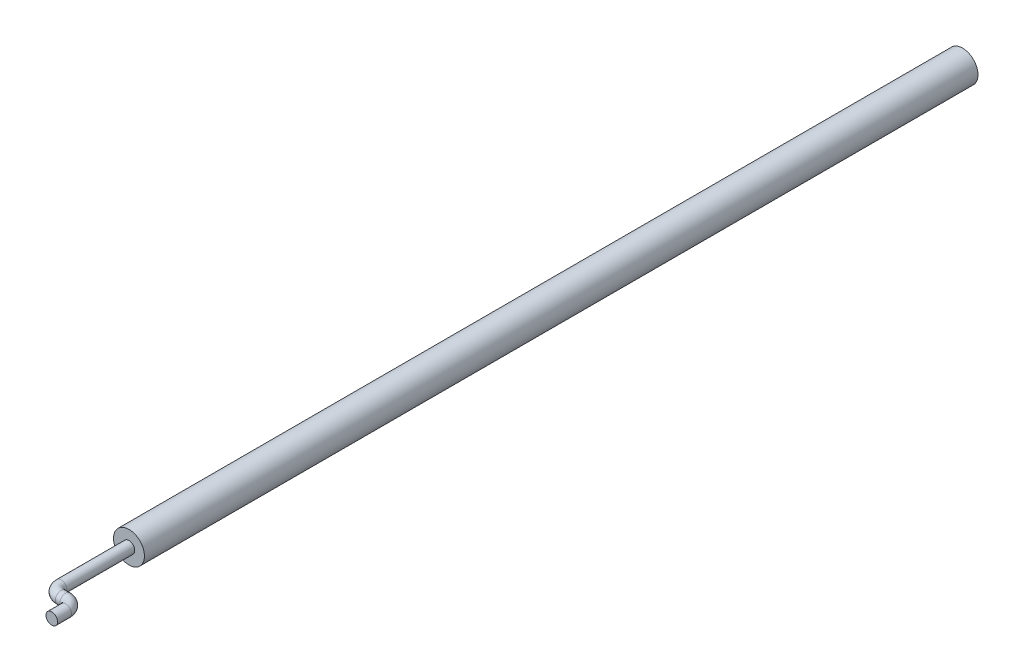
from build123d import *

# Parameters (mm, degrees)
SKETCH1_R           = 50.8
BOSS_EXTRUDE1_DEPTH = 2743.2
SKETCH6_R           = 19.05


with BuildPart() as part:
    # Sketch1 → Boss-Extrude1 (new body)
    with BuildSketch(Plane.XY):
        Circle(SKETCH1_R)
    extrude(amount=BOSS_EXTRUDE1_DEPTH)

    # Sweep1: sweep along a curve in space
    with BuildLine() as sweep1_path:
        Line((0, 0, 2743.2), (0, 0, 2966.72))
        ThreePointArc((30.48, 0, 2997.2), (8.927385309, 0, 2988.272614691), (0, 0, 2966.72))
        Line((30.48, 0, 2997.2), (45.72, 0, 2997.2))
        ThreePointArc((45.72, 0, 2997.2), (67.272614691, 0, 3006.127385309), (76.2, 0, 3027.68))
        Line((76.2, 0, 3027.68), (76.2, 0, 3073.4))
    # Sketch6 → Sweep1 (sweep)
    with BuildSketch(Plane.XY.offset(2743.2)):
        Circle(SKETCH6_R)
    sweep(path=sweep1_path.line)


solid = part.part
